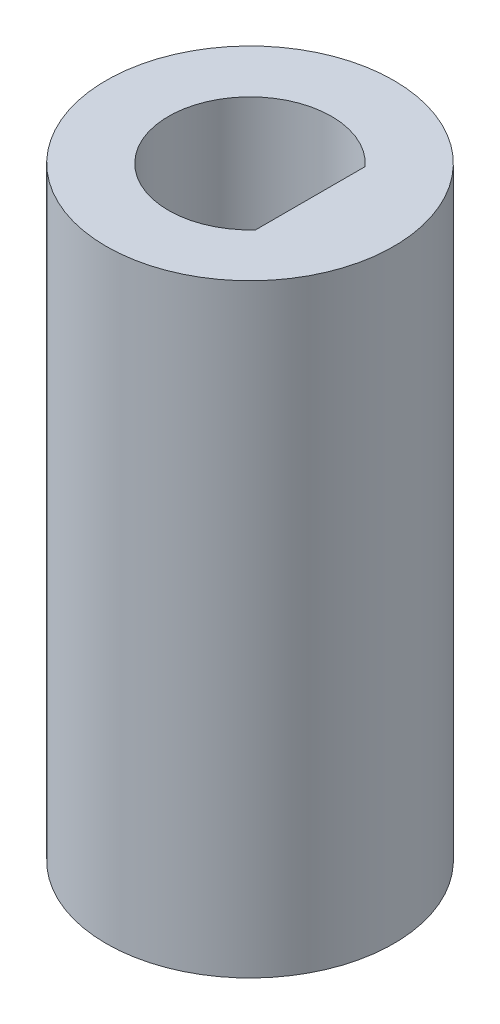
from build123d import *

# Parameters (mm, degrees)
SKETCH1_R           = 4.7625
BOSS_EXTRUDE1_DEPTH = 20


with BuildPart() as part:
    # Sketch1 → Boss-Extrude1 (new body)
    with BuildSketch(Plane(origin=(0, 0, 0), x_dir=(1, 0, 0), z_dir=(0, 1, 0))):
        with Locations(Location((0, 0, 0), (0, 0, 270))):
            Circle(SKETCH1_R)
        with BuildLine():
            Line((2, 1.813835715), (2, -1.813835715))
            ThreePointArc((2, -1.813835715), (-2.7, 0), (2, 1.813835715))
        make_face(mode=Mode.SUBTRACT)
    extrude(amount=BOSS_EXTRUDE1_DEPTH)


solid = part.part
